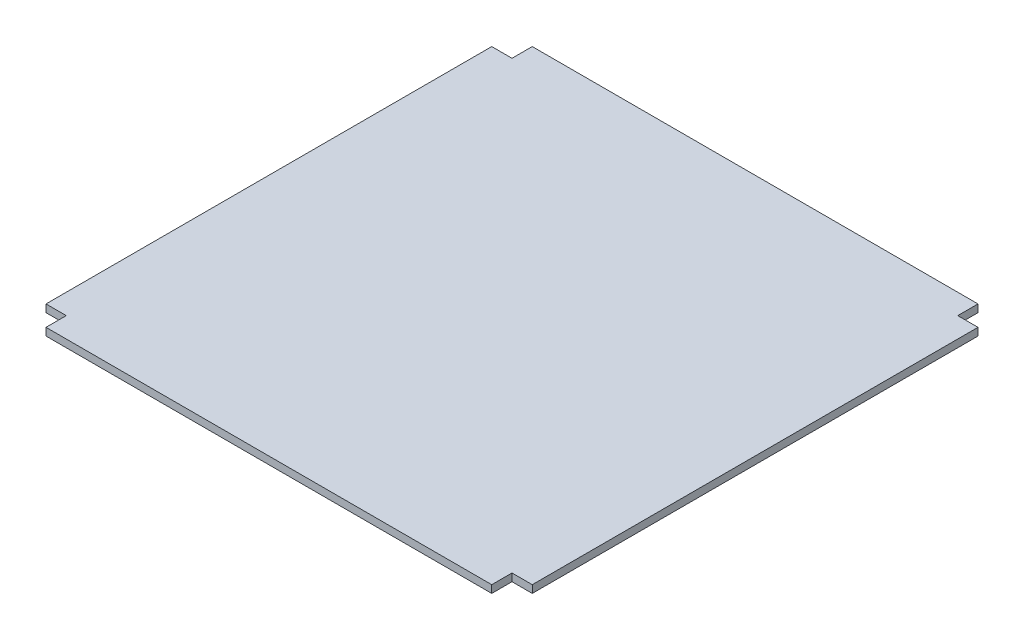
from build123d import *

# Parameters (mm, degrees)
SKETCH1_W           = 1219.2
SKETCH1_H           = 1219.2
BOSS_EXTRUDE1_DEPTH = 9.525
SKETCH2_W           = 50.8
SKETCH2_H           = 50.8
CUT_EXTRUDE1_DEPTH  = 863.315036689


with BuildPart() as part:
    # Sketch1 → Boss-Extrude1 (new, symmetric)
    with BuildSketch(Plane(origin=(0, 0, 0), x_dir=(1, 0, 0), z_dir=(0, 1, 0))):
        Rectangle(SKETCH1_W, SKETCH1_H)
    extrude(amount=BOSS_EXTRUDE1_DEPTH, both=True)

    # Sketch2 → Cut-Extrude1 (cut, through all)
    with BuildSketch(Plane(origin=(0, 9.525, 0), x_dir=(1, 0, 0), z_dir=(0, 1, 0))):
        with Locations((-584.2, 584.2)):
            Rectangle(SKETCH2_W, SKETCH2_H)
        with Locations((584.2, 584.2)):
            Rectangle(SKETCH2_W, SKETCH2_H)
        with Locations((584.2, -584.2)):
            Rectangle(SKETCH2_W, SKETCH2_H)
        with Locations((-584.2, -584.2)):
            Rectangle(SKETCH2_W, SKETCH2_H)
    extrude(amount=-CUT_EXTRUDE1_DEPTH, mode=Mode.SUBTRACT)


solid = part.part
